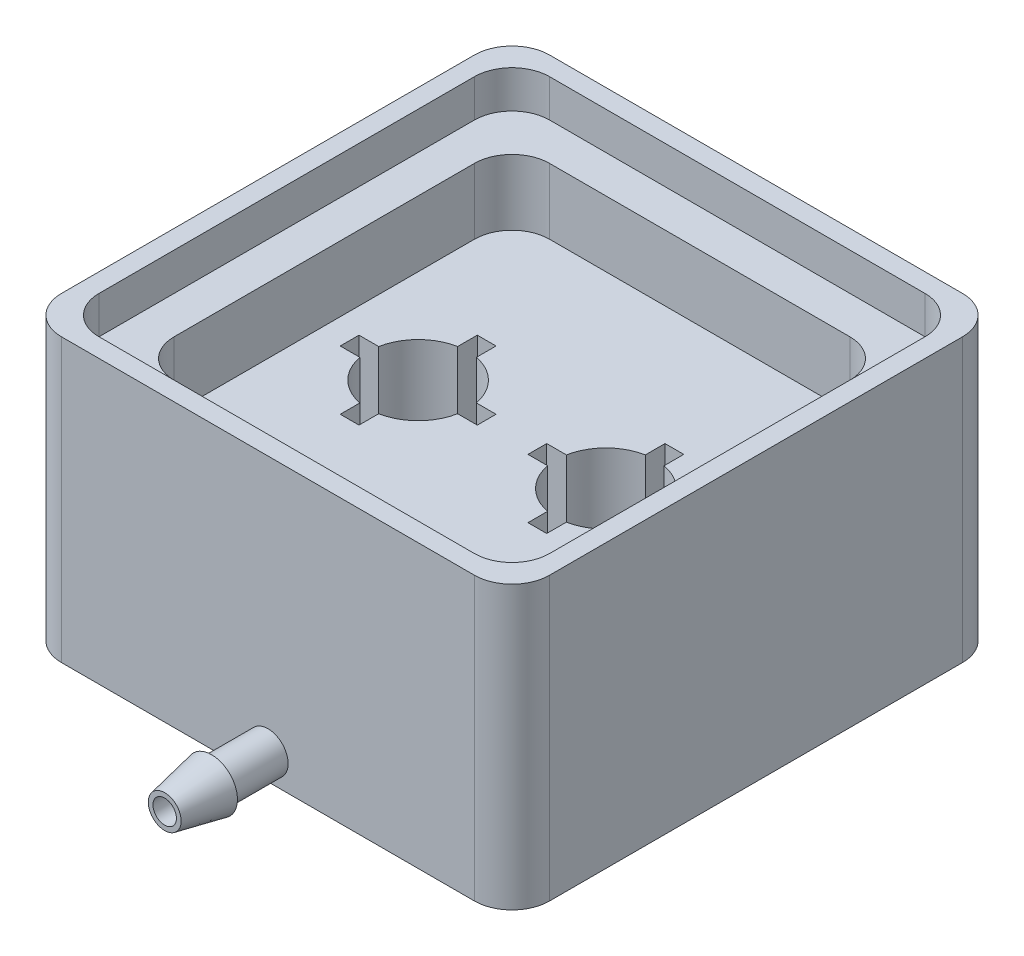
from build123d import *

# Parameters (mm, degrees)
SKETCH1_R                      = 2.65
BOSS_EXTRUDE1_DEPTH            = 9.53
CUT_EXTRUDE1_START             = -8.785
CUT_EXTRUDE1_DEPTH             = 8.785
CUT_EXTRUDE3_REACH             = 26.537
SKETCH10_R                     = 0.625
CUT_EXTRUDE3_DIRECTION_2_REACH = 26.537
CUT_EXTRUDE2_REACH             = 32.591
SKETCH5_R                      = 0.625
BOSS_EXTRUDE2_DEPTH            = 3.5
BOSS_EXTRUDE3_DEPTH            = 2


with BuildPart() as part:
    # Sketch1 → Boss-Extrude1 (new body)
    with BuildSketch(Plane(origin=(0, 0, 0), x_dir=(1, 0, 0), z_dir=(0, 1, 0))):
        with BuildLine():
            Line((-11, -13), (11, -13))
            ThreePointArc((11, -13), (12.414213562, -12.414213562), (13, -11))
            Line((13, -11), (13, 11))
            ThreePointArc((13, 11), (12.414213562, 12.414213562), (11, 13))
            Line((11, 13), (-11, 13))
            ThreePointArc((-11, 13), (-12.414213562, 12.414213562), (-13, 11))
            Line((-13, 11), (-13, -11))
            ThreePointArc((-13, -11), (-12.414213562, -12.414213562), (-11, -13))
        make_face()
        with Locations(Location((5, 0, 0), (0, 0, 270))):
            Circle(SKETCH1_R, mode=Mode.SUBTRACT)
        with Locations(Location((-5, 0, 0), (0, 0, 270))):
            Circle(SKETCH1_R, mode=Mode.SUBTRACT)
    extrude(amount=BOSS_EXTRUDE1_DEPTH)

    # Sketch2 → Cut-Extrude1 (cut)
    with BuildSketch(Plane(origin=(0, 9.53, 0), x_dir=(1, 0, 0), z_dir=(0, 1, 0)).offset(CUT_EXTRUDE1_START)):
        with BuildLine():
            Line((4.5, 3.65), (4.5, 2.602402736))
            ThreePointArc((4.5, 2.602402736), (5, 2.65), (5.5, 2.602402736))
            Line((5.5, 2.602402736), (5.5, 3.65))
            Line((5.5, 3.65), (4.5, 3.65))
        make_face()
        with BuildLine():
            ThreePointArc((7.65, 0), (7.638073848, -0.251130195), (7.602402736, -0.5))
            Line((7.602402736, -0.5), (8.65, -0.5))
            Line((8.65, -0.5), (8.65, 0.5))
            Line((8.65, 0.5), (7.602402736, 0.5))
            ThreePointArc((7.602402736, 0.5), (7.638073848, 0.251130195), (7.65, 0))
        make_face()
        with BuildLine():
            Line((4.5, -2.602402736), (4.5, -3.65))
            Line((4.5, -3.65), (5.5, -3.65))
            Line((5.5, -3.65), (5.5, -2.602402736))
            ThreePointArc((5.5, -2.602402736), (5, -2.65), (4.5, -2.602402736))
        make_face()
        with BuildLine():
            Line((1.35, -0.5), (2.397597264, -0.5))
            ThreePointArc((2.397597264, -0.5), (2.35, 0), (2.397597264, 0.5))
            Line((2.397597264, 0.5), (1.35, 0.5))
            Line((1.35, 0.5), (1.35, -0.5))
        make_face()
        with BuildLine():
            ThreePointArc((-2.35, 0), (-2.361926152, -0.251130195), (-2.397597264, -0.5))
            Line((-2.397597264, -0.5), (-1.35, -0.5))
            Line((-1.35, -0.5), (-1.35, 0.5))
            Line((-1.35, 0.5), (-2.397597264, 0.5))
            ThreePointArc((-2.397597264, 0.5), (-2.361926152, 0.251130195), (-2.35, 0))
        make_face()
        with BuildLine():
            Line((-5.5, 3.65), (-5.5, 2.602402736))
            ThreePointArc((-5.5, 2.602402736), (-5, 2.65), (-4.5, 2.602402736))
            Line((-4.5, 2.602402736), (-4.5, 3.65))
            Line((-4.5, 3.65), (-5.5, 3.65))
        make_face()
        with BuildLine():
            Line((-8.65, 0.5), (-8.65, -0.5))
            Line((-8.65, -0.5), (-7.602402736, -0.5))
            ThreePointArc((-7.602402736, -0.5), (-7.65, 0), (-7.602402736, 0.5))
            Line((-7.602402736, 0.5), (-8.65, 0.5))
        make_face()
        with BuildLine():
            ThreePointArc((-4.5, -2.602402736), (-5, -2.65), (-5.5, -2.602402736))
            Line((-5.5, -2.602402736), (-5.5, -3.65))
            Line((-5.5, -3.65), (-4.5, -3.65))
            Line((-4.5, -3.65), (-4.5, -2.602402736))
        make_face()
    extrude(amount=CUT_EXTRUDE1_DEPTH, mode=Mode.SUBTRACT)

    # Sketch3 → Revolve1 (revolve)
    with BuildSketch(Plane(origin=(0, 0, 0), x_dir=(0, 0, -1), z_dir=(1, 0, 0)), mode=Mode.PRIVATE) as revolve1_sk:
        Polygon((-13, 0.3), (-16, 0.3), (-16, 0), (-18.5, 0.5), (-18.5, 0.75), (-13, 0.75), align=None)
    revolve(revolve1_sk.sketch.rotate(Axis((0, 1.375, 13), (0, 0, 1)), 180), axis=Axis((0, 1.375, 13), (0, 0, 1)))

    # Sketch10 → Cut-Extrude3 (cut, up to next)
    with BuildSketch(Plane(origin=(0, 0, 0), x_dir=(0, 0, -1), z_dir=(1, 0, 0)), mode=Mode.PRIVATE) as cut_extrude3_sk1:
        with Locations(Location((0, 1.375, 0), (0, 0, 143.130102406))):
            Circle(SKETCH10_R)
    cut_extrude3_tool1 = extrude(cut_extrude3_sk1.sketch, amount=-CUT_EXTRUDE3_REACH, mode=Mode.PRIVATE) & part.part
    add(cut_extrude3_tool1.solids().sort_by_distance((0, 1.375, 0))[0], mode=Mode.SUBTRACT)

    # Sketch10 → Cut-Extrude3 direction 2 (cut, up to next)
    with BuildSketch(Plane(origin=(0, 0, 0), x_dir=(0, 0, -1), z_dir=(1, 0, 0)), mode=Mode.PRIVATE) as cut_extrude3_direction_2_sk1:
        with Locations(Location((0, 1.375, 0), (0, 0, 143.130102406))):
            Circle(SKETCH10_R)
    cut_extrude3_direction_2_tool1 = extrude(cut_extrude3_direction_2_sk1.sketch, amount=CUT_EXTRUDE3_DIRECTION_2_REACH, mode=Mode.PRIVATE) & part.part
    add(cut_extrude3_direction_2_tool1.solids().sort_by_distance((0, 1.375, 0))[0], mode=Mode.SUBTRACT)

    # Sketch5 → Cut-Extrude2 (cut, up to next)
    with BuildSketch(Plane.XY.offset(13), mode=Mode.PRIVATE) as cut_extrude2_sk1:
        with Locations(Location((0, 1.375, 0), (0, 0, 90))):
            Circle(SKETCH5_R)
    cut_extrude2_tool1 = extrude(cut_extrude2_sk1.sketch, amount=-CUT_EXTRUDE2_REACH, mode=Mode.PRIVATE) & part.part
    add(cut_extrude2_tool1.solids().sort_by_distance((0, 1.375, 13))[0], mode=Mode.SUBTRACT)

    # Sketch6 → Boss-Extrude2 (add)
    with BuildSketch(Plane(origin=(0, 9.53, 0), x_dir=(1, 0, 0), z_dir=(0, 1, 0))):
        with BuildLine():
            Line((-11, -13), (11, -13))
            ThreePointArc((11, -13), (12.414213562, -12.414213562), (13, -11))
            Line((13, -11), (13, 11))
            ThreePointArc((13, 11), (12.414213562, 12.414213562), (11, 13))
            Line((11, 13), (-11, 13))
            ThreePointArc((-11, 13), (-12.414213562, 12.414213562), (-13, 11))
            Line((-13, 11), (-13, -11))
            ThreePointArc((-13, -11), (-12.414213562, -12.414213562), (-11, -13))
        make_face()
        with BuildLine():
            Line((-8, -10), (8, -10))
            ThreePointArc((8, -10), (9.414213562, -9.414213562), (10, -8))
            Line((10, -8), (10, 8))
            ThreePointArc((10, 8), (9.414213562, 9.414213562), (8, 10))
            Line((8, 10), (-8, 10))
            ThreePointArc((-8, 10), (-9.414213562, 9.414213562), (-10, 8))
            Line((-10, 8), (-10, -8))
            ThreePointArc((-10, -8), (-9.414213562, -9.414213562), (-8, -10))
        make_face(mode=Mode.SUBTRACT)
    extrude(amount=BOSS_EXTRUDE2_DEPTH)

    # Sketch8 → Boss-Extrude3 (add)
    with BuildSketch(Plane(origin=(0, 13.03, 0), x_dir=(1, 0, 0), z_dir=(0, 1, 0))):
        with BuildLine():
            Line((-11, -13), (11, -13))
            ThreePointArc((11, -13), (12.414213562, -12.414213562), (13, -11))
            Line((13, -11), (13, 11))
            ThreePointArc((13, 11), (12.414213562, 12.414213562), (11, 13))
            Line((11, 13), (-11, 13))
            ThreePointArc((-11, 13), (-12.414213562, 12.414213562), (-13, 11))
            Line((-13, 11), (-13, -11))
            ThreePointArc((-13, -11), (-12.414213562, -12.414213562), (-11, -13))
        make_face()
        with BuildLine():
            Line((-10, -12), (10, -12))
            ThreePointArc((10, -12), (11.414213562, -11.414213562), (12, -10))
            Line((12, -10), (12, 10))
            ThreePointArc((12, 10), (11.414213562, 11.414213562), (10, 12))
            Line((10, 12), (-10, 12))
            ThreePointArc((-10, 12), (-11.414213562, 11.414213562), (-12, 10))
            Line((-12, 10), (-12, -10))
            ThreePointArc((-12, -10), (-11.414213562, -11.414213562), (-10, -12))
        make_face(mode=Mode.SUBTRACT)
    extrude(amount=BOSS_EXTRUDE3_DEPTH)


solid = part.part
